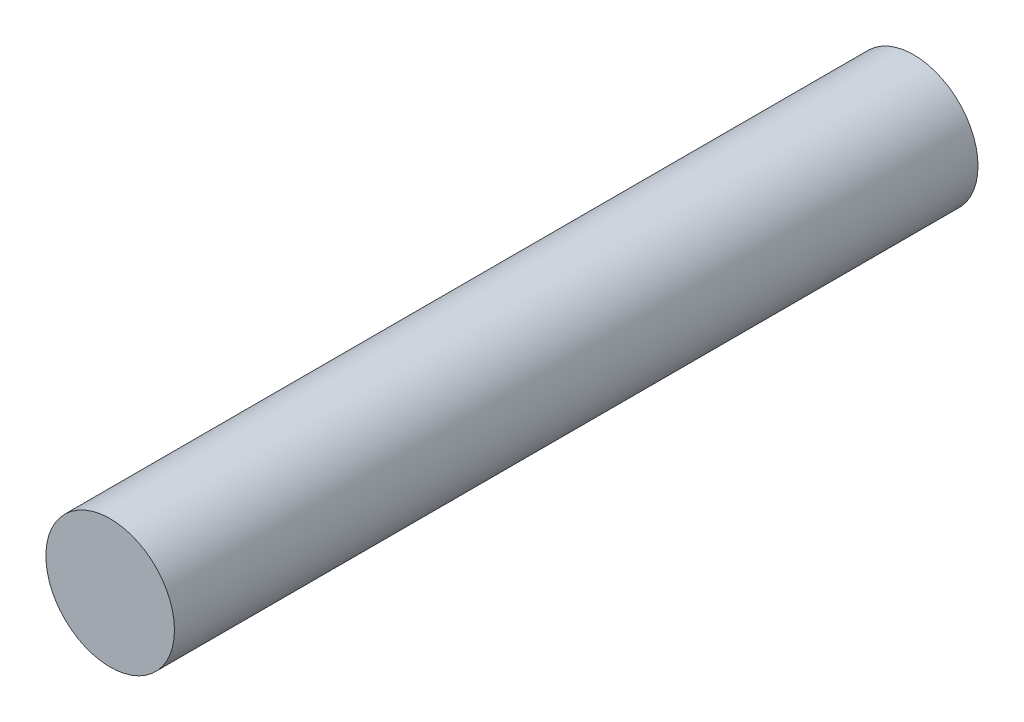
from build123d import *

# Parameters (mm, degrees)
ESQUISSE2_R        = 2.032
BOSS_EXTRU_1_DEPTH = 12.7


with BuildPart() as part:
    # Esquisse2 → Boss.-Extru.1 (new, symmetric)
    with BuildSketch(Plane.XY):
        Circle(ESQUISSE2_R)
    extrude(amount=BOSS_EXTRU_1_DEPTH, both=True)


solid = part.part
